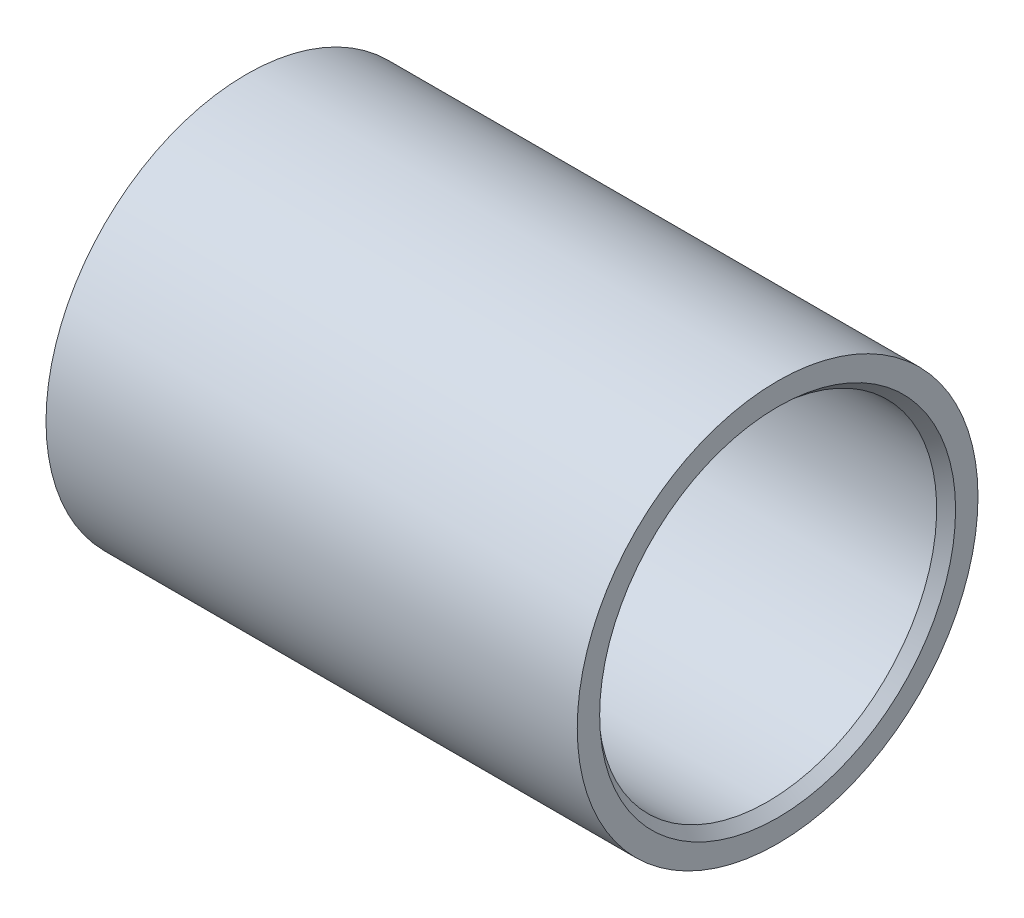
from build123d import *


with BuildPart() as part:
    # Sketch1 → Revolve1 (revolve)
    with BuildSketch(Plane.XY):
        Polygon((-18.668542663, 13.502685322), (-17.903957341, 12.7381), (20.569457337, 12.7381), (21.331457337, 13.399370559), (21.331457337, 15.0876), (-18.668542663, 15.0876), align=None)
    revolve(axis=Axis((-18.668542663, 0, 0), (1, 0, 0)))


solid = part.part
